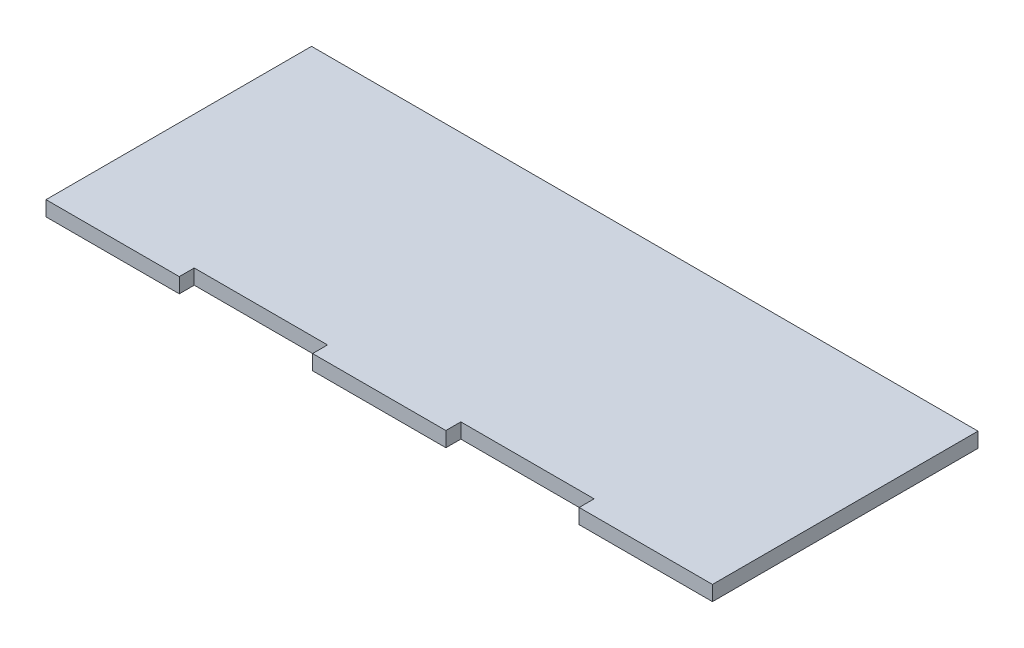
from build123d import *

# Parameters (mm, degrees)
SKETCH1_W           = 509.74752
SKETCH1_H           = 203.09332
BOSS_EXTRUDE1_DEPTH = 11.43
SKETCH2_W           = 101.949504
SKETCH2_H           = 11.43
CUT_EXTRUDE1_DEPTH  = 487.220192945


with BuildPart() as part:
    # Sketch1 → Boss-Extrude1 (new body)
    with BuildSketch(Plane(origin=(0, 0, 0), x_dir=(1, 0, 0), z_dir=(0, 1, 0))):
        with Locations((185.152766772, 104.986840587)):
            Rectangle(SKETCH1_W, SKETCH1_H)
    extrude(amount=BOSS_EXTRUDE1_DEPTH)

    # Sketch2 → Cut-Extrude1 (cut, through all)
    with BuildSketch(Plane.XZ):
        with Locations((287.102270772, -9.155180587)):
            Rectangle(SKETCH2_W, SKETCH2_H)
        with Locations((83.203262772, -9.155180587)):
            Rectangle(SKETCH2_W, SKETCH2_H)
    extrude(amount=-CUT_EXTRUDE1_DEPTH, mode=Mode.SUBTRACT)


solid = part.part
